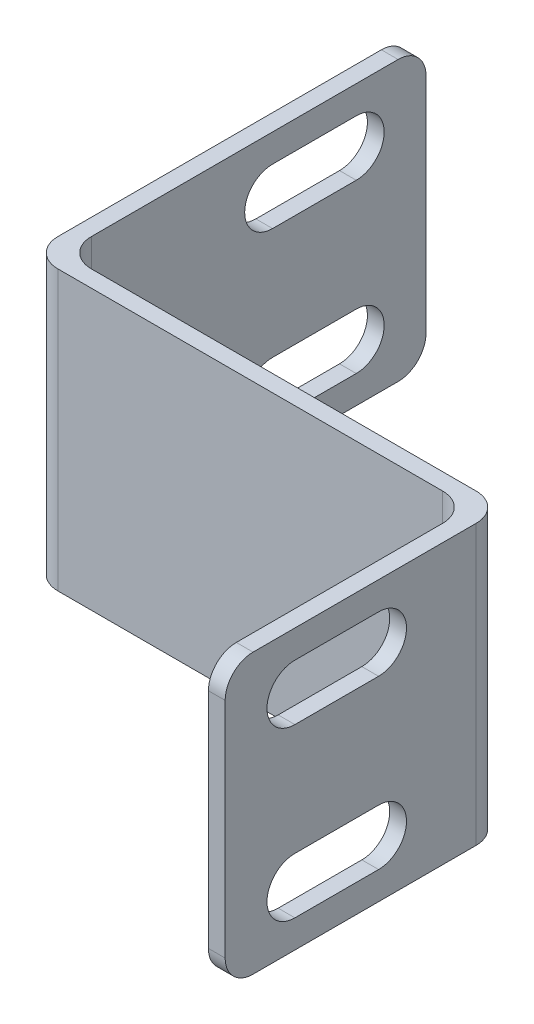
from build123d import *

# Parameters (mm, degrees)
BOSS_EXTRUDE1_DEPTH = 50
FILLET1_R           = 5
CUT_EXTRUDE1_DEPTH  = 3
CUT_EXTRUDE2_DEPTH  = 3
FILLET2_R           = 5


with BuildPart() as part:
    # Sketch1 → Boss-Extrude1 (new body)
    with BuildSketch(Plane(origin=(0, 0, 0), x_dir=(1, 0, 0), z_dir=(0, 1, 0))):
        Polygon((0, 0), (0, -65), (79, -65), (79, -115), (76, -115), (76, -68), (-3, -68), (-3, 0), align=None)
    extrude(amount=BOSS_EXTRUDE1_DEPTH)

    # Fillet1
    fillet1_edges = [part.edges().sort_by_distance(p)[0] for p in [
        (0, 25, 65),
        (79, 25, 65),
        (76, 25, 68),
        (-3, 25, 68),
    ]]
    fillet(fillet1_edges, radius=FILLET1_R)

    # Sketch2 → Cut-Extrude1 (cut)
    with BuildSketch(Plane.ZY.offset(-76)):
        with BuildLine():
            Line((87.5, 45), (102.5, 45))
            ThreePointArc((102.5, 45), (107.5, 40), (102.5, 35))
            Line((102.5, 35), (87.5, 35))
            ThreePointArc((87.5, 35), (82.5, 40), (87.5, 45))
        make_face()
        with BuildLine():
            Line((87.5, 15), (102.5, 15))
            ThreePointArc((102.5, 15), (107.5, 10), (102.5, 5))
            Line((102.5, 5), (87.5, 5))
            ThreePointArc((87.5, 5), (82.5, 10), (87.5, 15))
        make_face()
    extrude(amount=-CUT_EXTRUDE1_DEPTH, mode=Mode.SUBTRACT)

    # Sketch3 → Cut-Extrude2 (cut)
    with BuildSketch(Plane.ZY.offset(3)):
        with BuildLine():
            Line((12.5, 45), (27.5, 45))
            ThreePointArc((27.5, 45), (32.5, 40), (27.5, 35))
            Line((27.5, 35), (12.5, 35))
            ThreePointArc((12.5, 35), (7.5, 40), (12.5, 45))
        make_face()
        with BuildLine():
            Line((12.5, 15), (27.5, 15))
            ThreePointArc((27.5, 15), (32.5, 10), (27.5, 5))
            Line((27.5, 5), (12.5, 5))
            ThreePointArc((12.5, 5), (7.5, 10), (12.5, 15))
        make_face()
    extrude(amount=-CUT_EXTRUDE2_DEPTH, mode=Mode.SUBTRACT)

    # Fillet2
    fillet2_edges = [part.edges().sort_by_distance(p)[0] for p in [
        (-1.5, 0, 0),
        (77.5, 50, 115),
        (-1.5, 50, 0),
        (77.5, 0, 115),
    ]]
    fillet(fillet2_edges, radius=FILLET2_R)


solid = part.part
